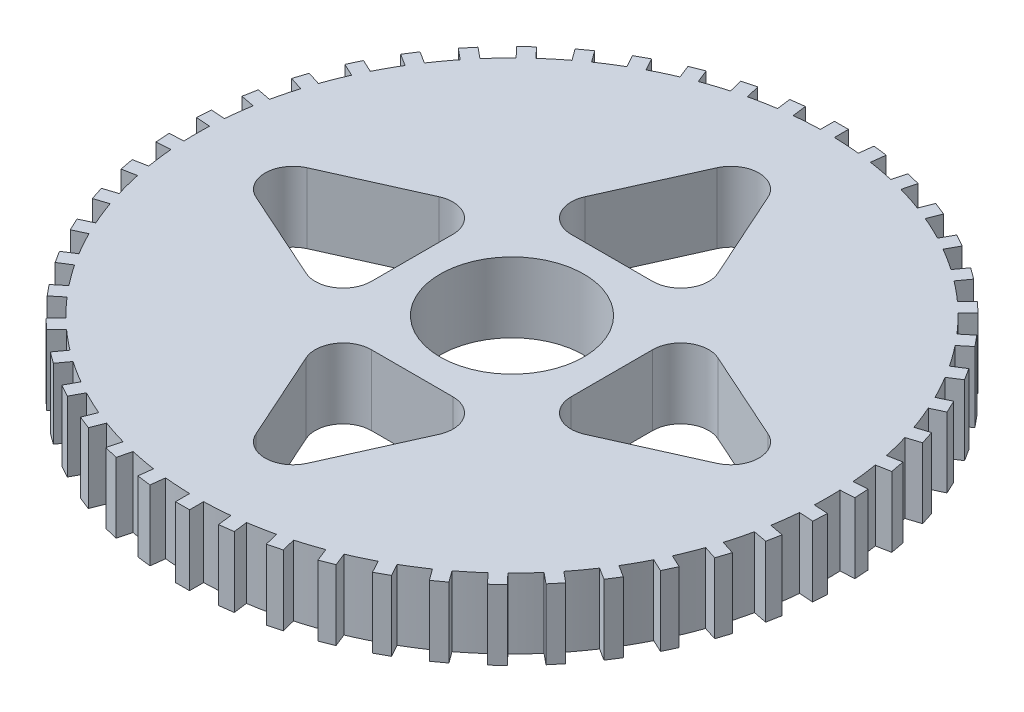
from build123d import *

# Parameters (mm, degrees)
SKETCH1_R           = 22.5
BOSS_EXTRUDE1_DEPTH = 5
SKETCH2_R           = 5.125
CUT_EXTRUDE1_DEPTH  = 5
CUT_EXTRUDE2_DEPTH  = 5
FILLET1_R           = 2
BOSS_EXTRUDE2_START = -5
BOSS_EXTRUDE2_DEPTH = 5
CIRPATTERN1_COUNT   = 50


with BuildPart() as part:
    # Sketch1 → Boss-Extrude1 (new body)
    with BuildSketch(Plane(origin=(0, 0, 0), x_dir=(1, 0, 0), z_dir=(0, 1, 0))):
        with Locations(Location((0, 0, 0), (0, 0, 270))):
            Circle(SKETCH1_R)
    extrude(amount=BOSS_EXTRUDE1_DEPTH)

    # Sketch2 → Cut-Extrude1 (cut)
    with BuildSketch(Plane(origin=(0, 5, 0), x_dir=(1, 0, 0), z_dir=(0, 1, 0))):
        with Locations(Location((0, 0, 0), (0, 0, 270))):
            Circle(SKETCH2_R)
    extrude(amount=-CUT_EXTRUDE1_DEPTH, mode=Mode.SUBTRACT)

    # Sketch3 → Cut-Extrude2 (cut)
    with BuildSketch(Plane(origin=(0, 5, 0), x_dir=(1, 0, 0), z_dir=(0, 1, 0))):
        Polygon((7.125, 0), (7.125, 6), (20.5, 0), (7.125, -6), align=None)
        Polygon((0, 7.125), (6, 7.125), (0, 20.5), (-6, 7.125), align=None)
        Polygon((0, -7.125), (6, -7.125), (0, -20.5), (-6, -7.125), align=None)
        Polygon((-7.125, 0), (-7.125, -6), (-20.5, 0), (-7.125, 6), align=None)
    extrude(amount=-CUT_EXTRUDE2_DEPTH, mode=Mode.SUBTRACT)

    # Fillet1
    fillet1_edges = [part.edges().sort_by_distance(p)[0] for p in [
        (7.125, 2.5, 6),
        (7.125, 2.5, -6),
        (20.5, 2.5, 0),
        (-6, 2.5, -7.125),
        (0, 2.5, -20.5),
        (6, 2.5, -7.125),
        (-6, 2.5, 7.125),
        (6, 2.5, 7.125),
        (0, 2.5, 20.5),
        (-7.125, 2.5, -6),
        (-7.125, 2.5, 6),
        (-20.5, 2.5, 0),
    ]]
    fillet(fillet1_edges, radius=FILLET1_R)

    # Sketch4 → Boss-Extrude2 (add)
    with BuildSketch(Plane(origin=(0, 5, 0), x_dir=(1, 0, 0), z_dir=(0, 1, 0)).offset(BOSS_EXTRUDE2_START)):
        with BuildLine():
            Line((0, 23.5), (0, 22.5))
            ThreePointArc((0, 22.5), (0.250015435, 22.498610897), (0.5, 22.494443758))
            Line((0.5, 22.494443758), (0.5, 23.5))
            Line((0.5, 23.5), (0, 23.5))
        make_face()
        with BuildLine():
            ThreePointArc((-0.5, 22.494443758), (-0.250015435, 22.498610897), (0, 22.5))
            Line((0, 22.5), (0, 23.5))
            Line((0, 23.5), (-0.5, 23.5))
            Line((-0.5, 23.5), (-0.5, 22.494443758))
        make_face()
    boss_extrude2 = extrude(amount=BOSS_EXTRUDE2_DEPTH)

    # CirPattern1: Boss-Extrude2 ×50 about axis
    cirpattern1_axis = Axis((0, 0, 0), (0, 1, 0))
    for i in range(1, CIRPATTERN1_COUNT):
        add(boss_extrude2.rotate(cirpattern1_axis, i * 360 / CIRPATTERN1_COUNT))


solid = part.part
